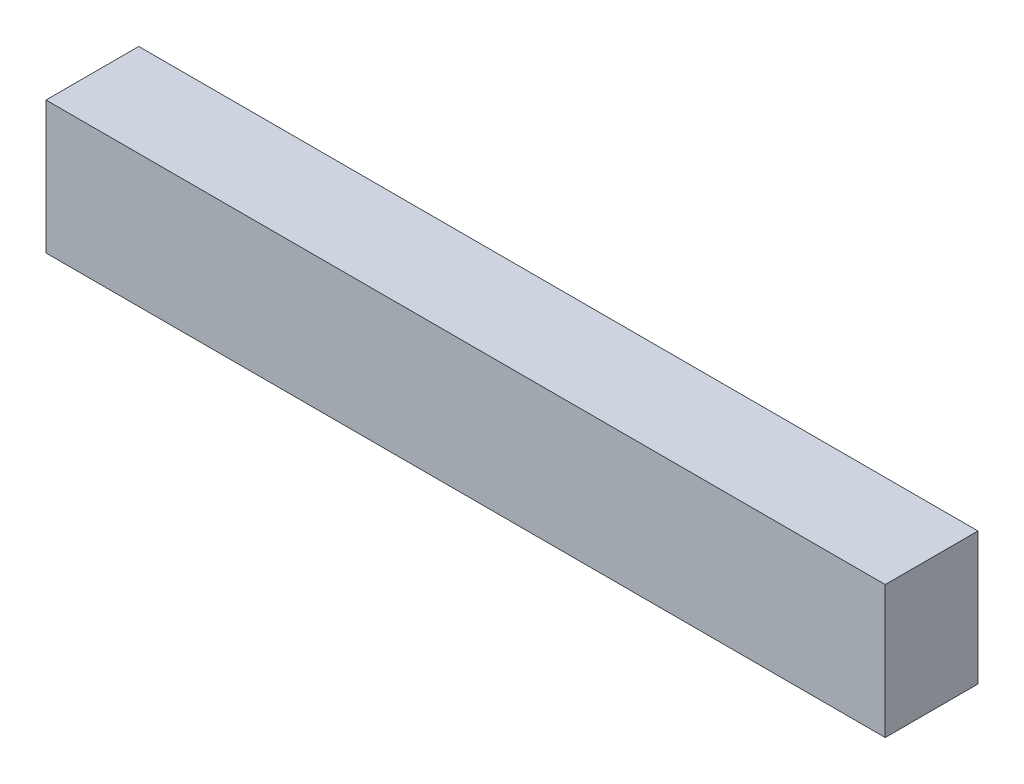
from build123d import *

# Parameters (mm, degrees)
SKETCH1_W           = 48.26
SKETCH1_H           = 7.62
BOSS_EXTRUDE1_DEPTH = 5.334


with BuildPart() as part:
    # Sketch1 → Boss-Extrude1 (new body)
    with BuildSketch(Plane.XY):
        with Locations((-10.330766538, 9.69950632)):
            Rectangle(SKETCH1_W, SKETCH1_H)
    extrude(amount=BOSS_EXTRUDE1_DEPTH)


solid = part.part
